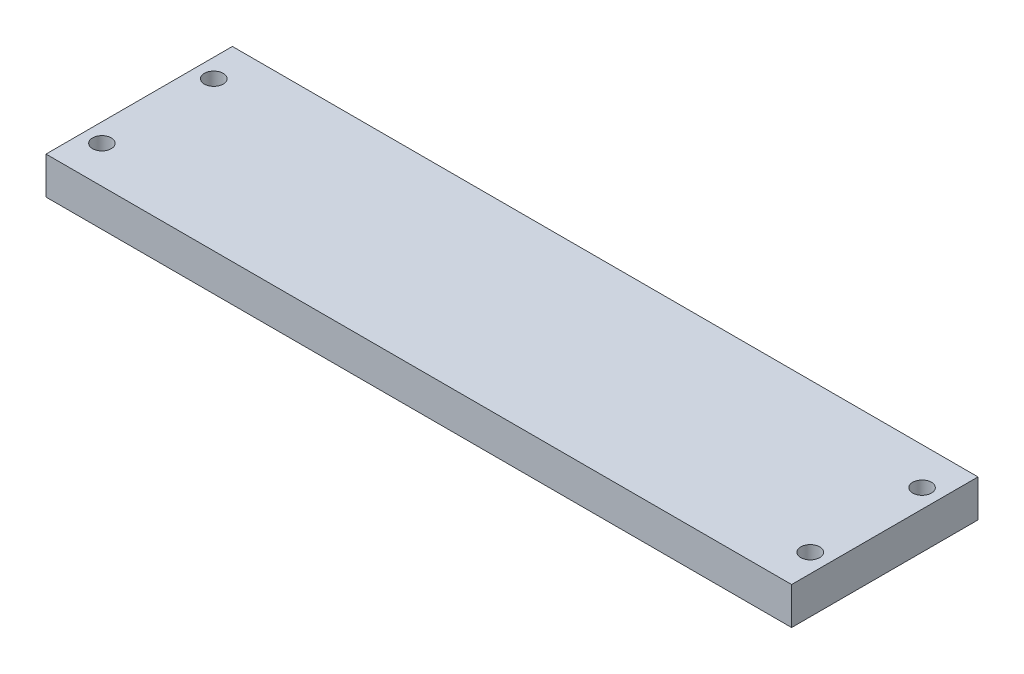
from build123d import *

# Parameters (mm, degrees)
SKETCH1_W                                       = 127
SKETCH1_H                                       = 31.75
BOSS_EXTRUDE1_DEPTH                             = 3.175
CSK_FOR_M3_FLAT_HEAD_MACHINE_SCREW1_D           = 3.2
CSK_FOR_M3_FLAT_HEAD_MACHINE_SCREW1_DEPTH       = 12.7
CSK_FOR_M3_FLAT_HEAD_MACHINE_SCREW1_CSINK_D     = 6.3
CSK_FOR_M3_FLAT_HEAD_MACHINE_SCREW1_CSINK_ANGLE = 90
CSK_FOR_M3_FLAT_HEAD_MACHINE_SCREW1_TIP         = 0.96137699


with BuildPart() as part:
    # Sketch1 → Boss-Extrude1 (new, symmetric)
    with BuildSketch(Plane(origin=(0, 0, 0), x_dir=(1, 0, 0), z_dir=(0, 1, 0))):
        Rectangle(SKETCH1_W, SKETCH1_H)
    extrude(amount=BOSS_EXTRUDE1_DEPTH, both=True)

    # CSK for M3 Flat Head Machine Screw1
    with Locations(Plane(origin=(0, -3.175, 0), x_dir=(-1, 0, 0), z_dir=(0, -1, 0))):
        with Locations((60.325, -9.525), (60.325, 9.525), (-60.325, -9.525), (-60.325, 9.525)):
            CounterSinkHole(CSK_FOR_M3_FLAT_HEAD_MACHINE_SCREW1_D / 2, CSK_FOR_M3_FLAT_HEAD_MACHINE_SCREW1_CSINK_D / 2, depth=CSK_FOR_M3_FLAT_HEAD_MACHINE_SCREW1_DEPTH, counter_sink_angle=CSK_FOR_M3_FLAT_HEAD_MACHINE_SCREW1_CSINK_ANGLE)
            with Locations((0, 0, -(CSK_FOR_M3_FLAT_HEAD_MACHINE_SCREW1_DEPTH + CSK_FOR_M3_FLAT_HEAD_MACHINE_SCREW1_TIP / 2))):  # 118° drill point
                Cone(0, CSK_FOR_M3_FLAT_HEAD_MACHINE_SCREW1_D / 2, CSK_FOR_M3_FLAT_HEAD_MACHINE_SCREW1_TIP, mode=Mode.SUBTRACT)


solid = part.part
